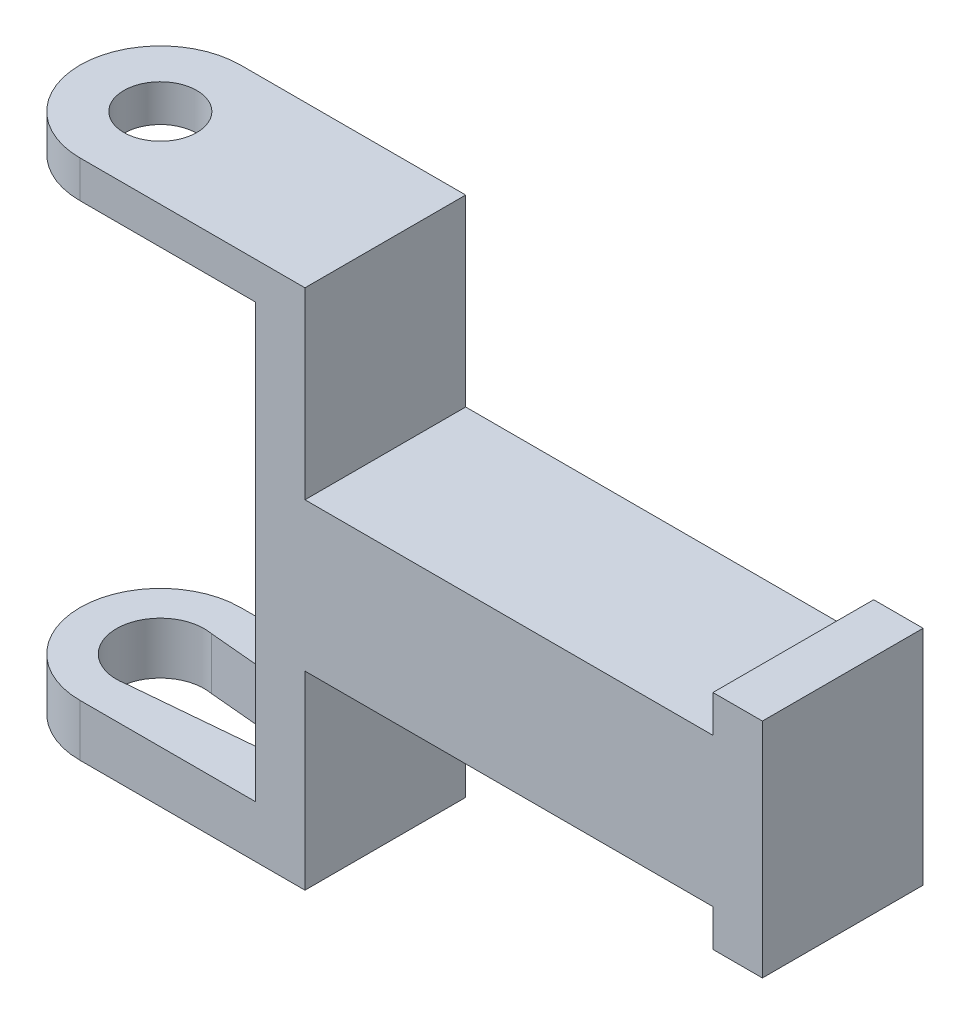
from build123d import *

# Parameters (mm, degrees)
BOSS_EXTRUDE1_START = -3
SKETCH1_W           = 13
SKETCH1_H           = 42.2
BOSS_EXTRUDE1_DEPTH = 2
BOSS_EXTRUDE2_START = -87.25
SKETCH2_R           = 6.5
BOSS_EXTRUDE2_DEPTH = 2.1
BOSS_EXTRUDE3_START = -87.25
SKETCH3_W           = 18.2
SKETCH3_H           = 13
BOSS_EXTRUDE3_DEPTH = 2.1
CUT_EXTRUDE1_START  = -87.25
SKETCH4_R           = 3.55
CUT_EXTRUDE1_DEPTH  = 2.1
CUT_EXTRUDE2_START  = -87.25
CUT_EXTRUDE2_DEPTH  = 2.1
BOSS_EXTRUDE4_START = -48.65
SKETCH6_R           = 6.5
BOSS_EXTRUDE4_DEPTH = 1.5
BOSS_EXTRUDE5_START = -48.65
SKETCH7_W           = 18.2
SKETCH7_H           = 13
BOSS_EXTRUDE5_DEPTH = 1.5
CUT_EXTRUDE3_START  = -48.65
SKETCH8_R           = 2.95
CUT_EXTRUDE3_DEPTH  = 1.5
BOSS_EXTRUDE6_START = 17
SKETCH9_W           = 13
SKETCH9_H           = 12
BOSS_EXTRUDE6_DEPTH = 19
BOSS_EXTRUDE7_START = 34
SKETCH10_W          = 13
SKETCH10_H          = 18
BOSS_EXTRUDE7_DEPTH = 2


with BuildPart() as part:
    # Sketch1 → Boss-Extrude1 (new, symmetric)
    with BuildSketch(Plane(origin=(0, 0, 0), x_dir=(0, 0, -1), z_dir=(1, 0, 0)).offset(BOSS_EXTRUDE1_START)):
        with Locations((0, -68.25)):
            Rectangle(SKETCH1_W, SKETCH1_H)
    extrude(amount=BOSS_EXTRUDE1_DEPTH, both=True)



with BuildPart() as body_2:
    # Sketch2 → Boss-Extrude2 (new, symmetric)
    with BuildSketch(Plane(origin=(0, 0, 0), x_dir=(1, 0, 0), z_dir=(0, 1, 0)).offset(BOSS_EXTRUDE2_START)):
        with Locations(Location((-19.2, 0, 0), (0, 0, 270))):
            Circle(SKETCH2_R)
    extrude(amount=BOSS_EXTRUDE2_DEPTH, both=True)


with BuildPart() as part_1:
    add(part.part)

    add(body_2.part)  # Boss-Extrude3 merges body 2
    # Sketch3 → Boss-Extrude3 (add, symmetric)
    with BuildSketch(Plane(origin=(0, 0, 0), x_dir=(1, 0, 0), z_dir=(0, 1, 0)).offset(BOSS_EXTRUDE3_START)):
        with Locations((-10.1, 0)):
            Rectangle(SKETCH3_W, SKETCH3_H)
    extrude(amount=BOSS_EXTRUDE3_DEPTH, both=True)

    # Sketch4 → Cut-Extrude1 (cut, symmetric)
    with BuildSketch(Plane(origin=(0, 0, 0), x_dir=(1, 0, 0), z_dir=(0, 1, 0)).offset(CUT_EXTRUDE1_START)):
        with Locations(Location((-19.2, 0, 0), (0, 0, 270))):
            Circle(SKETCH4_R)
    extrude(amount=CUT_EXTRUDE1_DEPTH, both=True, mode=Mode.SUBTRACT)

    # Sketch5 → Cut-Extrude2 (cut, symmetric)
    with BuildSketch(Plane(origin=(0, 0, 0), x_dir=(1, 0, 0), z_dir=(0, 1, 0)).offset(CUT_EXTRUDE2_START)):
        Polygon((-19.2, -3.55), (-6.5, -2.403281405), (-6.5, 2.403281405), (-19.2, 3.55), align=None)
    extrude(amount=CUT_EXTRUDE2_DEPTH, both=True, mode=Mode.SUBTRACT)



with BuildPart() as body_2_2:
    # Sketch6 → Boss-Extrude4 (new, symmetric)
    with BuildSketch(Plane(origin=(0, 0, 0), x_dir=(1, 0, 0), z_dir=(0, 1, 0)).offset(BOSS_EXTRUDE4_START)):
        with Locations(Location((-19.2, 0, 0), (0, 0, 270))):
            Circle(SKETCH6_R)
    extrude(amount=BOSS_EXTRUDE4_DEPTH, both=True)


with BuildPart() as part_2:
    add(part_1.part)

    add(body_2_2.part)  # Boss-Extrude5 merges body 2 2
    # Sketch7 → Boss-Extrude5 (add, symmetric)
    with BuildSketch(Plane(origin=(0, 0, 0), x_dir=(1, 0, 0), z_dir=(0, 1, 0)).offset(BOSS_EXTRUDE5_START)):
        with Locations((-10.1, 0)):
            Rectangle(SKETCH7_W, SKETCH7_H)
    extrude(amount=BOSS_EXTRUDE5_DEPTH, both=True)

    # Sketch8 → Cut-Extrude3 (cut, symmetric)
    with BuildSketch(Plane(origin=(0, 0, 0), x_dir=(1, 0, 0), z_dir=(0, 1, 0)).offset(CUT_EXTRUDE3_START)):
        with Locations(Location((-19.2, 0, 0), (0, 0, 270))):
            Circle(SKETCH8_R)
    extrude(amount=CUT_EXTRUDE3_DEPTH, both=True, mode=Mode.SUBTRACT)

    # Sketch9 → Boss-Extrude6 (add, symmetric)
    with BuildSketch(Plane(origin=(0, 0, 0), x_dir=(0, 0, -1), z_dir=(1, 0, 0)).offset(BOSS_EXTRUDE6_START)):
        with Locations((0, -68)):
            Rectangle(SKETCH9_W, SKETCH9_H)
    extrude(amount=BOSS_EXTRUDE6_DEPTH, both=True)

    # Sketch10 → Boss-Extrude7 (add, symmetric)
    with BuildSketch(Plane(origin=(0, 0, 0), x_dir=(0, 0, -1), z_dir=(1, 0, 0)).offset(BOSS_EXTRUDE7_START)):
        with Locations((0, -68)):
            Rectangle(SKETCH10_W, SKETCH10_H)
    extrude(amount=BOSS_EXTRUDE7_DEPTH, both=True)


solid = part_2.part
